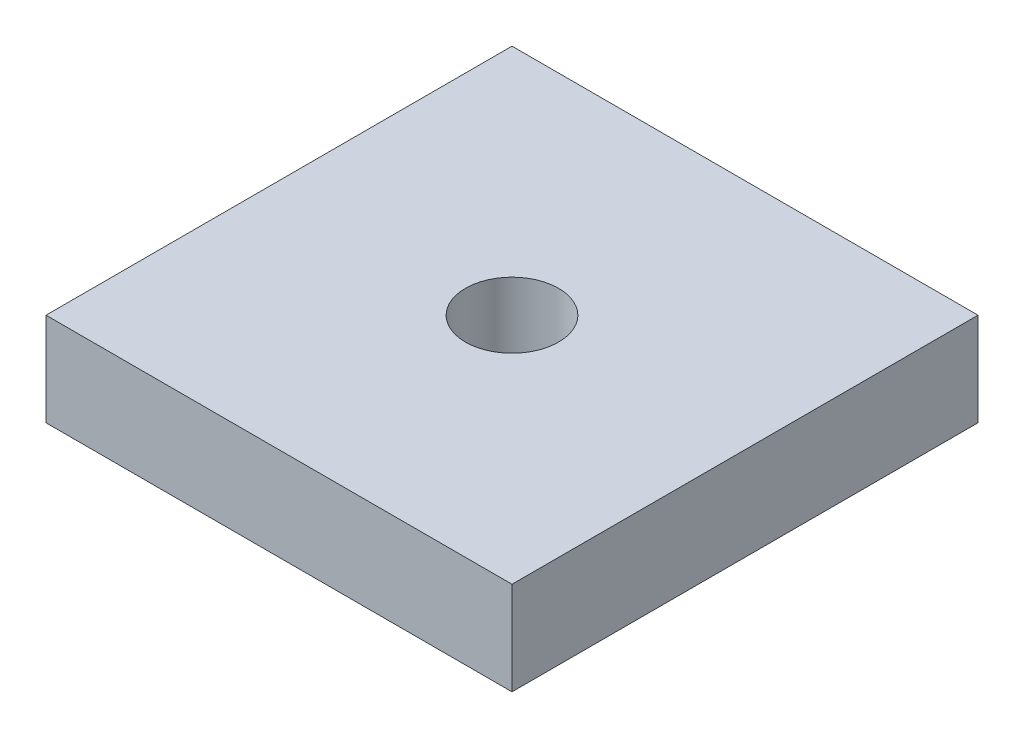
from build123d import *

# Parameters (mm, degrees)
SKETCH_1_W          = 50
SKETCH_1_H          = 50
EXTRUDE_2_DEPTH     = 10
SKETCH_3_R          = 5
CUT_EXTRUDE_2_DEPTH = 37.742346142


with BuildPart() as part:
    # Эскиз1 → Бобышка-Вытянуть2 (new body)
    with BuildSketch(Plane(origin=(0, 0, 0), x_dir=(1, 0, 0), z_dir=(0, 1, 0))):
        Rectangle(SKETCH_1_W, SKETCH_1_H)
    extrude(amount=EXTRUDE_2_DEPTH)

    # Эскиз3 → Вырез-Вытянуть2 (cut, through all)
    with BuildSketch(Plane(origin=(0, 10, 0), x_dir=(1, 0, 0), z_dir=(0, 1, 0))):
        with Locations(Location((0, 0, 0), (0, 0, 270))):
            Circle(SKETCH_3_R)
    extrude(amount=-CUT_EXTRUDE_2_DEPTH, mode=Mode.SUBTRACT)


solid = part.part
